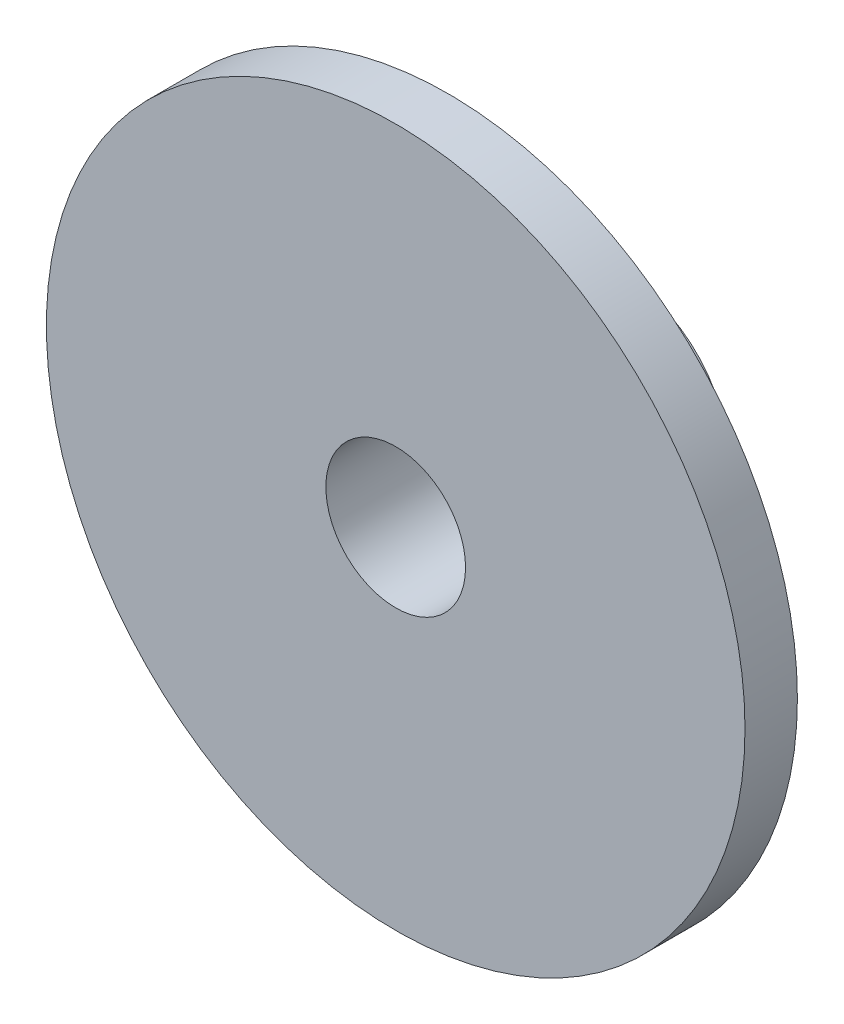
from build123d import *


with BuildPart() as part:
    # Sketch1 → Revolve1 (revolve)
    with BuildSketch(Plane(origin=(0, 0, 0), x_dir=(0, 0, -1), z_dir=(1, 0, 0)), mode=Mode.PRIVATE) as revolve1_sk:
        Polygon((0, 4), (13, 4), (13, 6), (3, 6), (3, 20), (0, 20), align=None)
    revolve(revolve1_sk.sketch.rotate(Axis((0, 0, 0), (0, 0, -1)), 90), axis=Axis((0, 0, 0), (0, 0, -1)))


solid = part.part
